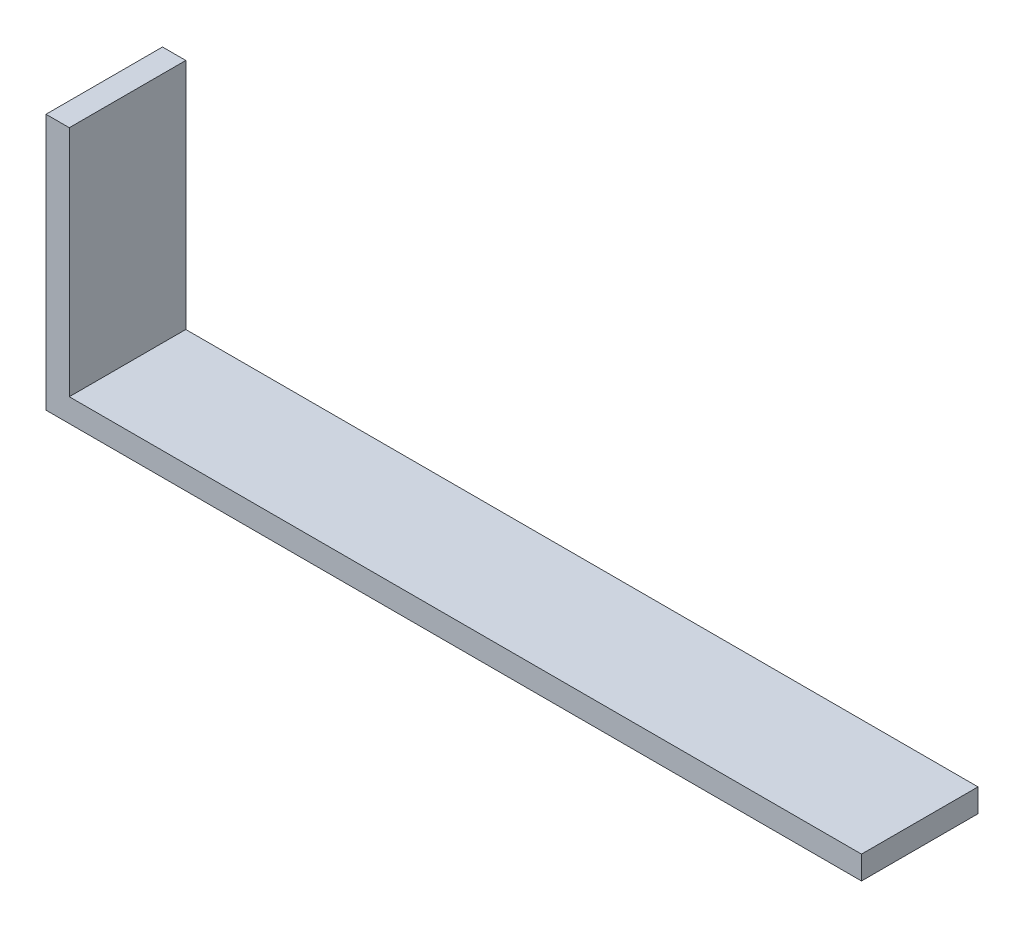
from build123d import *

# Parameters (mm, degrees)
BOSS_EXTRUDE1_DEPTH = 6.35


with BuildPart() as part:
    # Sketch1 → Boss-Extrude1 (new body)
    with BuildSketch(Plane.XY):
        Polygon((0, 5.981290323), (0, -7.988709677), (44.45, -7.988709677), (44.45, -6.718709677), (1.27, -6.718709677), (1.27, 5.981290323), align=None)
    extrude(amount=BOSS_EXTRUDE1_DEPTH)


solid = part.part
